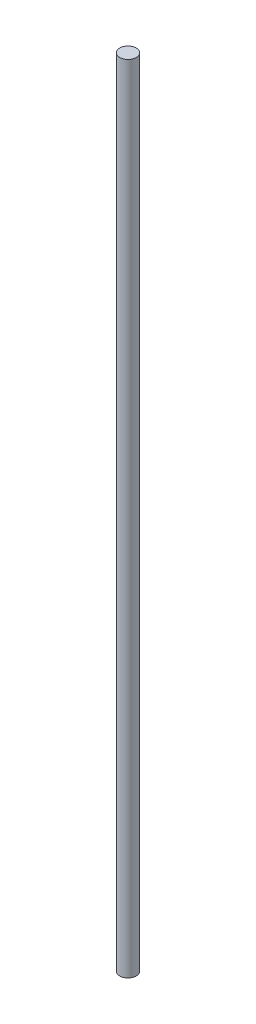
from build123d import *

# Parameters (mm, degrees)
SKETCH1_R           = 4
BOSS_EXTRUDE1_DEPTH = 385.75


with BuildPart() as part:
    # Sketch1 → Boss-Extrude1 (new body)
    with BuildSketch(Plane(origin=(0, 0, 0), x_dir=(1, 0, 0), z_dir=(0, 1, 0))):
        with Locations(Location((0, 0, 0), (0, 0, 270))):
            Circle(SKETCH1_R)
    extrude(amount=BOSS_EXTRUDE1_DEPTH)


solid = part.part
